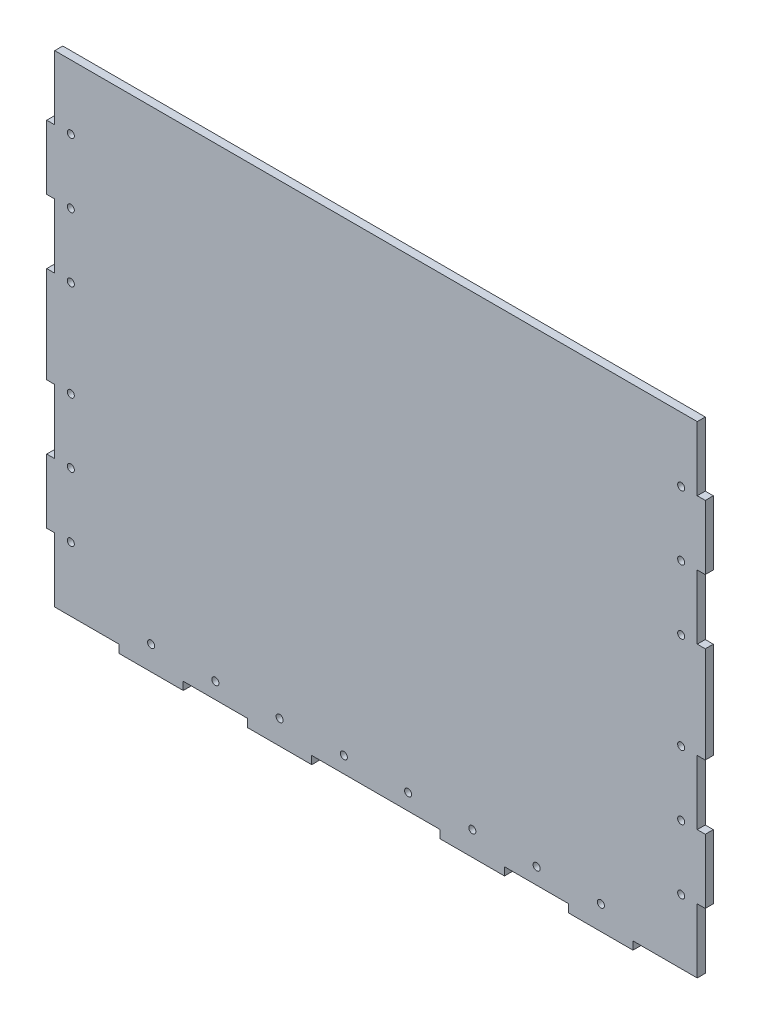
from build123d import *

# Parameters (mm, degrees)
SKETCH_1_R      = 2.2
EXTRUDE_1_DEPTH = 5


with BuildPart() as part:
    # 草图1 → 凸台-拉伸1 (new body)
    with BuildSketch(Plane.XY):
        Polygon((-200, 150), (200, 150), (200, 110), (205, 110), (205, 70), (200, 70), (200, 30), (205, 30), (205, -30), (200, -30), (200, -70), (205, -70), (205, -110), (200, -110), (200, -150), (160, -150), (160, -155), (120, -155), (120, -150), (80, -150), (80, -155), (40, -155), (40, -150), (-40, -150), (-40, -155), (-80, -155), (-80, -150), (-120, -150), (-120, -155), (-160, -155), (-160, -150), (-200, -150), (-200, -110), (-205, -110), (-205, -70), (-200, -70), (-200, -30), (-205, -30), (-205, 30), (-200, 30), (-200, 70), (-205, 70), (-205, 110), (-200, 110), align=None)
        with Locations((-140, -140)):
            Circle(SKETCH_1_R, mode=Mode.SUBTRACT)
        with Locations((-100, -140)):
            Circle(SKETCH_1_R, mode=Mode.SUBTRACT)
        with Locations((-60, -140)):
            Circle(SKETCH_1_R, mode=Mode.SUBTRACT)
        with Locations((-20, -140)):
            Circle(SKETCH_1_R, mode=Mode.SUBTRACT)
        with Locations((20, -140)):
            Circle(SKETCH_1_R, mode=Mode.SUBTRACT)
        with Locations((60, -140)):
            Circle(SKETCH_1_R, mode=Mode.SUBTRACT)
        with Locations((100, -140)):
            Circle(SKETCH_1_R, mode=Mode.SUBTRACT)
        with Locations((140, -140)):
            Circle(SKETCH_1_R, mode=Mode.SUBTRACT)
        with Locations((-190, 110)):
            Circle(SKETCH_1_R, mode=Mode.SUBTRACT)
        with Locations((-190, 70)):
            Circle(SKETCH_1_R, mode=Mode.SUBTRACT)
        with Locations((-190, 30)):
            Circle(SKETCH_1_R, mode=Mode.SUBTRACT)
        with Locations((-190, -30)):
            Circle(SKETCH_1_R, mode=Mode.SUBTRACT)
        with Locations((-190, -70)):
            Circle(SKETCH_1_R, mode=Mode.SUBTRACT)
        with Locations((-190, -110)):
            Circle(SKETCH_1_R, mode=Mode.SUBTRACT)
        with Locations((190, -110)):
            Circle(SKETCH_1_R, mode=Mode.SUBTRACT)
        with Locations((190, -70)):
            Circle(SKETCH_1_R, mode=Mode.SUBTRACT)
        with Locations((190, -30)):
            Circle(SKETCH_1_R, mode=Mode.SUBTRACT)
        with Locations((190, 30)):
            Circle(SKETCH_1_R, mode=Mode.SUBTRACT)
        with Locations((190, 70)):
            Circle(SKETCH_1_R, mode=Mode.SUBTRACT)
        with Locations((190, 110)):
            Circle(SKETCH_1_R, mode=Mode.SUBTRACT)
    extrude(amount=EXTRUDE_1_DEPTH)


solid = part.part
